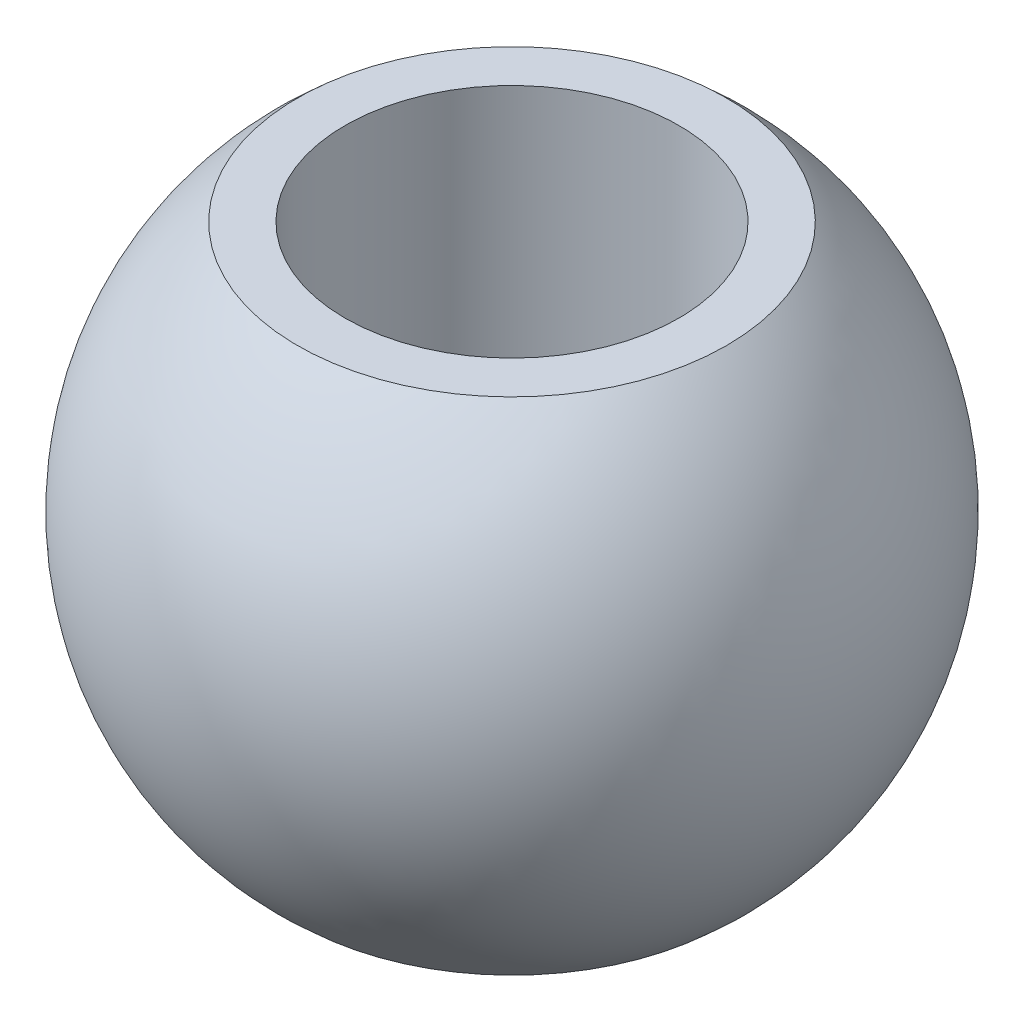
from build123d import *


with BuildPart() as part:
    # Sketch1 → Revolve1 (revolve)
    with BuildSketch(Plane(origin=(0, 0, 0), x_dir=(-1, 0, 0), z_dir=(0, 0, -1))):
        with BuildLine():
            Line((-5.139066063, -6), (-4, -6))
            Line((-4, -6), (-4, 6))
            Line((-4, 6), (-5.139066063, 6))
            ThreePointArc((-5.139066063, 6), (-7.9, 0), (-5.139066063, -6))
        make_face()
    revolve(axis=Axis((0, -6, 0), (0, 1, 0)))


solid = part.part
